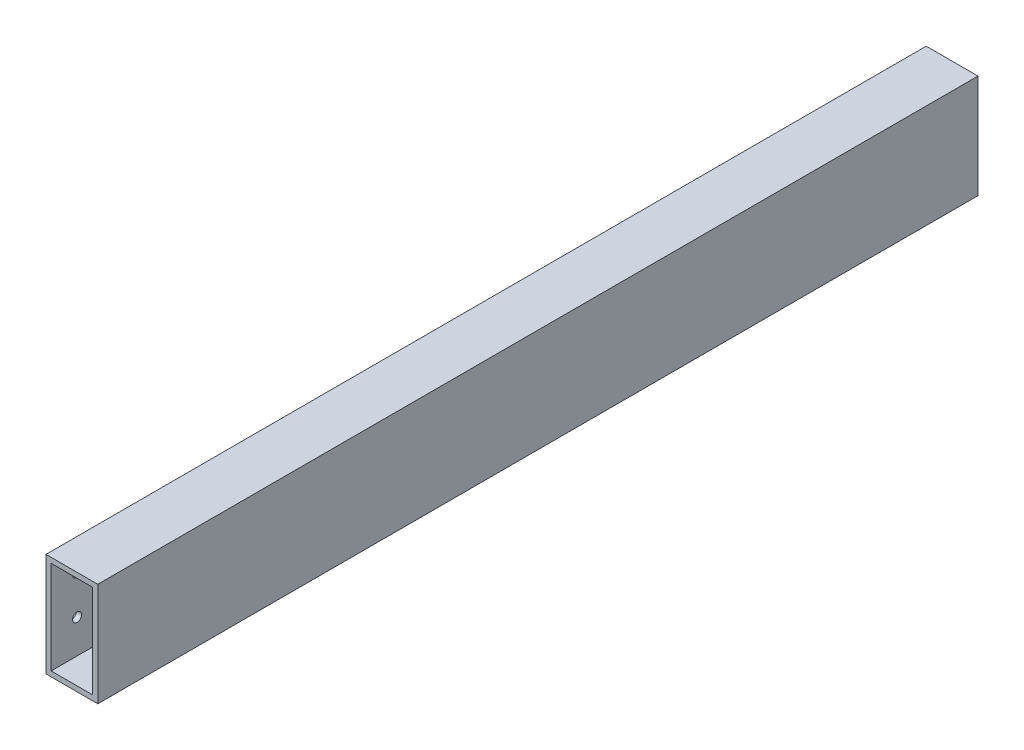
from build123d import *

# Parameters (mm, degrees)
ESBO_O1_W                = 20
ESBO_O1_H                = 40
ESBO_O1_W_2              = 16
ESBO_O1_H_2              = 36
RESSALTO_EXTRUS_O1_DEPTH = 340
ESBO_O2_R                = 1.75
CORTE_EXTRUS_O1_DEPTH    = 2


with BuildPart() as part:
    # Esboço1 → Ressalto-extrusão1 (new body)
    with BuildSketch(Plane.XY):
        with Locations((10, 20)):
            Rectangle(ESBO_O1_W, ESBO_O1_H)
        with Locations((10, 20)):
            Rectangle(ESBO_O1_W_2, ESBO_O1_H_2, mode=Mode.SUBTRACT)
    extrude(amount=RESSALTO_EXTRUS_O1_DEPTH)

    # Esboço2 → Corte-extrusão1 (cut)
    with BuildSketch(Plane.ZY):
        with Locations((10, 30)):
            Circle(ESBO_O2_R)
        with Locations((10, 15)):
            Circle(ESBO_O2_R)
        with Locations((70, 15)):
            Circle(ESBO_O2_R)
        with Locations((55, 15)):
            Circle(ESBO_O2_R)
        with Locations(Location((270, 15, 0), (0, 0, 180))):
            Circle(ESBO_O2_R)
        with Locations(Location((285, 15, 0), (0, 0, 180))):
            Circle(ESBO_O2_R)
        with Locations(Location((330, 15, 0), (0, 0, 180))):
            Circle(ESBO_O2_R)
        with Locations(Location((330, 30, 0), (0, 0, 180))):
            Circle(ESBO_O2_R)
    extrude(amount=-CORTE_EXTRUS_O1_DEPTH, mode=Mode.SUBTRACT)


solid = part.part
